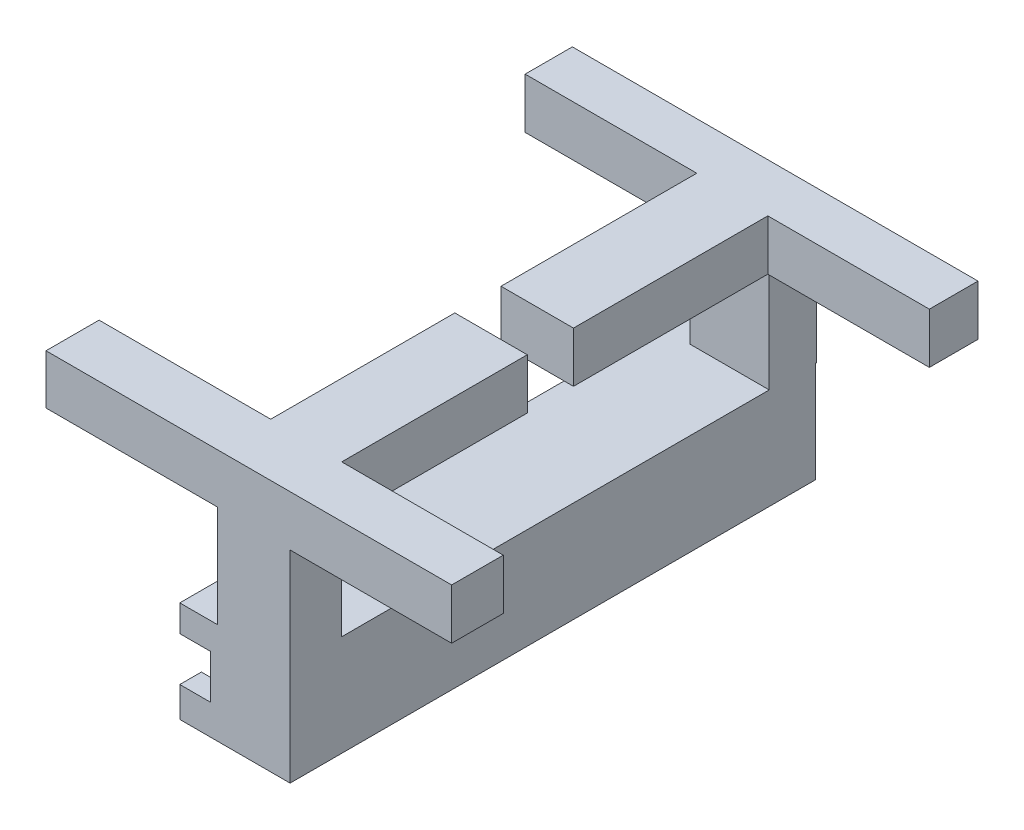
from build123d import *

# Parameters (mm, degrees)
SKETCH4_W            = 28.705590634
SKETCH4_H            = 208.526976526
BOSS_EXTRUDE5_DEPTH  = 20
SKETCH5_W            = 28.705590634
SKETCH5_H            = 20.449519005
SKETCH5_W_2          = 31.445291082
SKETCH5_H_2          = 18.706651284
BOSS_EXTRUDE6_DEPTH  = 40
SKETCH6_W            = 31.445291082
SKETCH6_H            = 208.079798694
BOSS_EXTRUDE7_DEPTH  = 40
SKETCH7_W            = 18.3
SKETCH7_H            = 20
CUT_EXTRUDE1_DEPTH   = 28.705590634
SKETCH8_W            = 208.079798694
SKETCH8_H            = 10.562870441
SKETCH8_H_2          = 11.993481809
BOSS_EXTRUDE8_DEPTH  = 15
SKETCH11_W           = 20
SKETCH11_H           = 32
CUT_EXTRUDE2_DEPTH   = 39
SKETCH12_W           = 21.023017078
SKETCH12_H           = 19.656473247
SKETCH12_W_2         = 18.706651284
SKETCH12_H_2         = 20
BOSS_EXTRUDE10_DEPTH = 68
SKETCH13_W           = 19.268882627
SKETCH13_H           = 20
SKETCH13_W_2         = 20.449519005
BOSS_EXTRUDE11_DEPTH = 64


with BuildPart() as part:
    # Sketch4 → Boss-Extrude5 (new body)
    with BuildSketch(Plane(origin=(0, -18, 0), x_dir=(1, 0, 0), z_dir=(0, 1, 0))):
        with Locations((-364.278541189, -59.921815566)):
            Rectangle(SKETCH4_W, SKETCH4_H)
    extrude(amount=BOSS_EXTRUDE5_DEPTH)

    # Sketch5 → Boss-Extrude6 (add)
    with BuildSketch(Plane.XZ.offset(18)):
        with Locations((-364.278541189, 153.960544327)):
            Rectangle(SKETCH5_W, SKETCH5_H)
        with Locations((-365.648391413, -34.988347055)):
            Rectangle(SKETCH5_W_2, SKETCH5_H_2)
    extrude(amount=BOSS_EXTRUDE6_DEPTH)

    # Sketch6 → Boss-Extrude7 (add)
    with BuildSketch(Plane.XZ.offset(58)):
        with Locations((-365.648391413, 60.145404482)):
            Rectangle(SKETCH6_W, SKETCH6_H)
    extrude(amount=BOSS_EXTRUDE7_DEPTH)

    # Sketch7 → Cut-Extrude1 (cut)
    with BuildSketch(Plane.ZY.offset(378.631336506)):
        with Locations((61.073274434, -8)):
            Rectangle(SKETCH7_W, SKETCH7_H)
    extrude(amount=-CUT_EXTRUDE1_DEPTH, mode=Mode.SUBTRACT)

    # Sketch8 → Boss-Extrude8 (add)
    with BuildSketch(Plane.ZY.offset(378.631336506)):
        with Locations((60.145404482, -63.281435221)):
            Rectangle(SKETCH8_W, SKETCH8_H)
        with Locations((60.145404482, -92.003259095)):
            Rectangle(SKETCH8_W, SKETCH8_H_2)
    extrude(amount=BOSS_EXTRUDE8_DEPTH)

    # Sketch11 → Cut-Extrude2 (cut)
    with BuildSketch(Plane.ZY.offset(393.631336506)):
        with Locations((145.629013926, -78.238745267)):
            Rectangle(SKETCH11_W, SKETCH11_H)
        with Locations((-23.889291997, -78.292410405)):
            Rectangle(SKETCH11_W, SKETCH11_H)
    extrude(amount=-CUT_EXTRUDE2_DEPTH, mode=Mode.SUBTRACT)

    # Sketch12 → Boss-Extrude10 (add)
    with BuildSketch(Plane.ZY.offset(378.631336506)):
        with Locations((153.67379529, -7.828236624)):
            Rectangle(SKETCH12_W, SKETCH12_H)
        with Locations((-34.988347055, -8)):
            Rectangle(SKETCH12_W_2, SKETCH12_H_2)
    extrude(amount=BOSS_EXTRUDE10_DEPTH)

    # Sketch13 → Boss-Extrude11 (add)
    with BuildSketch(Plane(origin=(-349.925745872, 0, 0), x_dir=(0, 0, -1), z_dir=(1, 0, 0))):
        with Locations((34.707231384, -8)):
            Rectangle(SKETCH13_W, SKETCH13_H)
        with Locations((-153.960544327, -8)):
            Rectangle(SKETCH13_W_2, SKETCH13_H)
    extrude(amount=BOSS_EXTRUDE11_DEPTH)


solid = part.part
